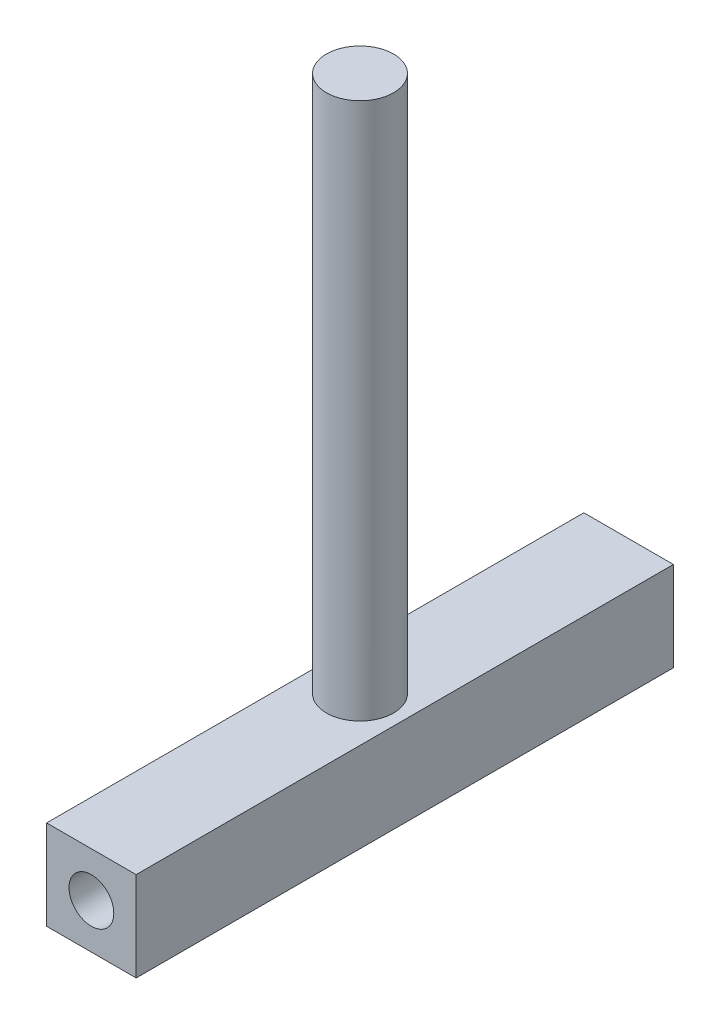
from build123d import *

# Parameters (mm, degrees)
SKETCH1_W           = 20
SKETCH1_H           = 20
SKETCH1_R           = 5
BOSS_EXTRUDE1_DEPTH = 120
SKETCH2_R           = 7.5
BOSS_EXTRUDE2_DEPTH = 120


with BuildPart() as part:
    # Sketch1 → Boss-Extrude1 (new body)
    with BuildSketch(Plane.XY):
        Rectangle(SKETCH1_W, SKETCH1_H)
        Circle(SKETCH1_R, mode=Mode.SUBTRACT)
    extrude(amount=BOSS_EXTRUDE1_DEPTH)

    # Sketch2 → Boss-Extrude2 (add)
    with BuildSketch(Plane(origin=(0, 10, 0), x_dir=(1, 0, 0), z_dir=(0, 1, 0))):
        with Locations(Location((0, -60, 0), (0, 0, 90))):
            Circle(SKETCH2_R)
    extrude(amount=BOSS_EXTRUDE2_DEPTH)


solid = part.part
